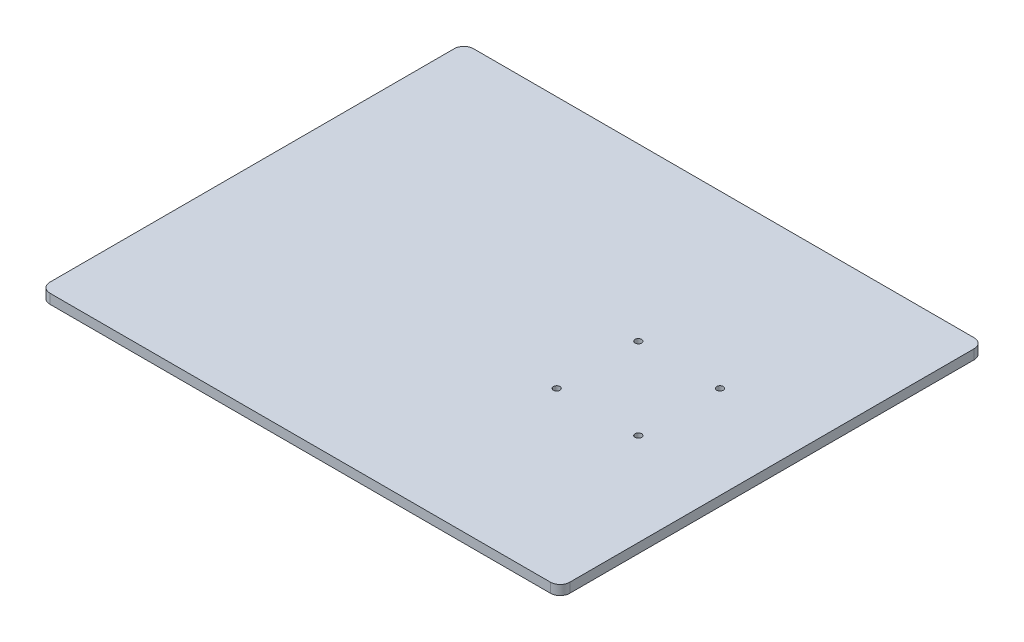
from build123d import *

# Parameters (mm, degrees)
EXTRUDE1_DEPTH        = 10
M8_TAPPED_HOLE1_D     = 6.8
M8_TAPPED_HOLE1_DEPTH = 19.75
M8_TAPPED_HOLE1_TIP   = 2.042926105


with BuildPart() as part:
    # Sketch1 → Extrude1 (new body)
    with BuildSketch(Plane(origin=(0, 0, 0), x_dir=(1, 0, 0), z_dir=(0, 1, 0))):
        with BuildLine():
            Line((260, -220), (-260, -220))
            ThreePointArc((-260, -220), (-267.071067812, -217.071067812), (-270, -210))
            Line((-270, -210), (-270, 210))
            ThreePointArc((-270, 210), (-267.071067812, 217.071067812), (-260, 220))
            Line((-260, 220), (260, 220))
            ThreePointArc((260, 220), (267.071067812, 217.071067812), (270, 210))
            Line((270, 210), (270, -210))
            ThreePointArc((270, -210), (267.071067812, -217.071067812), (260, -220))
        make_face()
    extrude(amount=EXTRUDE1_DEPTH)

    # M8 Tapped Hole1
    with Locations(Plane(origin=(88.815798741, 10, -42.426406871), x_dir=(0, 0, 1), z_dir=(0, 1, 0))):
        with Locations((0, 0), (84.852813742, 0), (84.852813742, 84.852813742), (0, 84.852813742)):
            Hole(M8_TAPPED_HOLE1_D / 2, depth=M8_TAPPED_HOLE1_DEPTH)
            with Locations((0, 0, -(M8_TAPPED_HOLE1_DEPTH + M8_TAPPED_HOLE1_TIP / 2))):  # 118° drill point
                Cone(0, M8_TAPPED_HOLE1_D / 2, M8_TAPPED_HOLE1_TIP, mode=Mode.SUBTRACT)


solid = part.part
